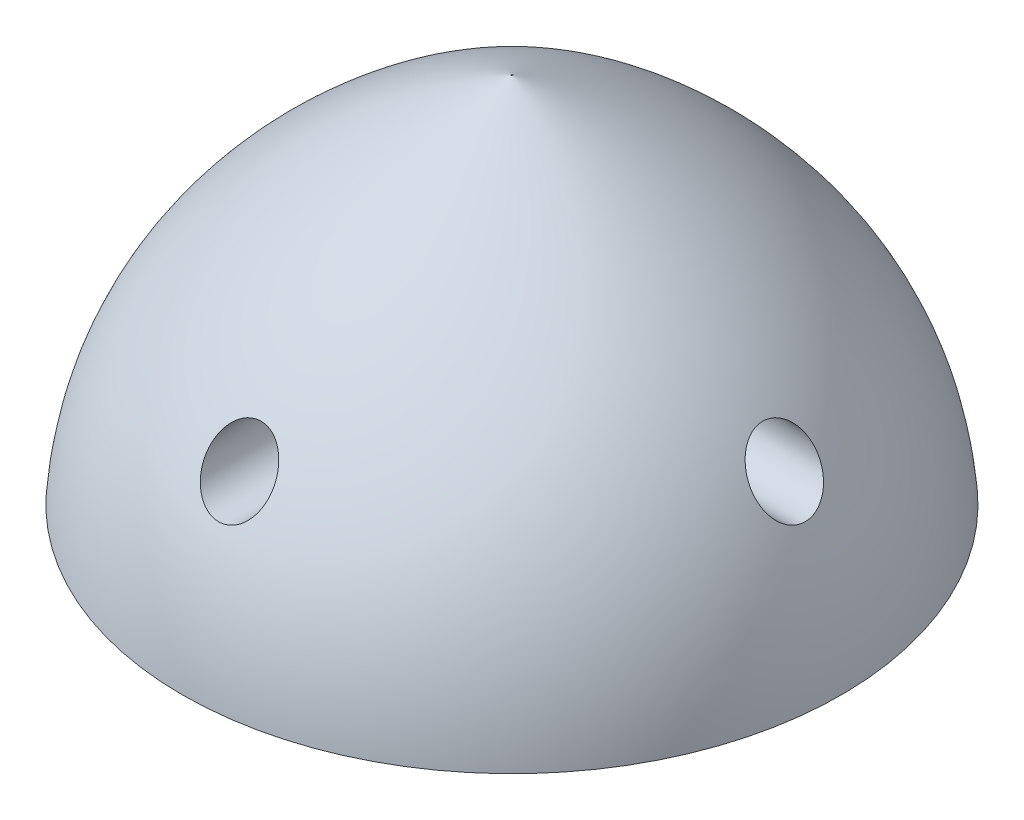
from build123d import *

# Parameters (mm, degrees)
SKETCH2_R          = 800
CUT_EXTRUDE1_DEPTH = 5333.333333333
CIRPATTERN1_COUNT  = 4


with BuildPart() as part:
    # Sketch1 → Revolve1 (revolve)
    with BuildSketch(Plane.XY, mode=Mode.PRIVATE) as revolve1_sk:
        with BuildLine():
            Line((0, 0), (8000, 0))
            add(Edge.make_bspline(
                [(13.110887759, 9028.633574294), (7529.852626364, 5849.053131887), (8000, 0)],
                knots=[0, 0, 0, 0.656149397, 0.656149397, 0.656149397], degree=2))
            Line((13.110887759, 9028.633574294), (0, 9000))
            Line((0, 9000), (0, 0))
        make_face()
    revolve(revolve1_sk.sketch.rotate(Axis((0, 52.187321795, 0), (0, -1, 0)), 90), axis=Axis((0, 52.187321795, 0), (0, -1, 0)))

    # Sketch2 → Cut-Extrude1 (cut)
    with BuildSketch(Plane.XY.offset(8000)):
        with Locations((0, 4000)):
            Circle(SKETCH2_R)
    cut_extrude1 = extrude(amount=-CUT_EXTRUDE1_DEPTH, mode=Mode.SUBTRACT)

    # CirPattern1: Cut-Extrude1 ×4 about axis
    cirpattern1_axis = Axis((0, 0, 0), (0, 1, 0))
    for i in range(1, CIRPATTERN1_COUNT):
        add(cut_extrude1.rotate(cirpattern1_axis, i * 360 / CIRPATTERN1_COUNT), mode=Mode.SUBTRACT)


solid = part.part
